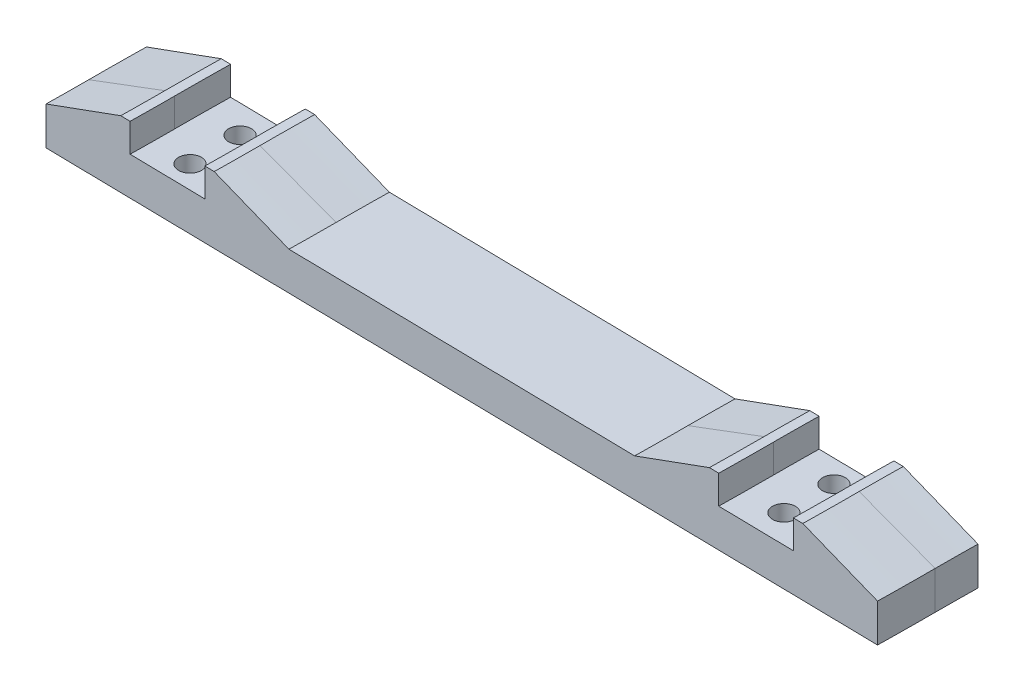
from build123d import *

# Parameters (mm, degrees)
EXTRUDE_1_DEPTH     = 2.5
SKETCH_5_R          = 0.6
CUT_EXTRUDE_1_DEPTH = 19.036421485
CUT_EXTRUDE_START   = -2
SKETCH_5_3_R        = 1
CUT_EXTRUDE_2_DEPTH = 1
REVOLVE_1_ANGLE     = 1
SKETCH_9_R          = 0.6
CUT_EXTRUDE_3_DEPTH = 41.426698916
SKETCH_9_3_R        = 1
CUT_EXTRUDE_4_DEPTH = 1
SKETCH_10_W         = 44.5
SKETCH_10_H         = 2.5
CUT_EXTRUDE_5_DEPTH = 41.528606999
REVOLVE_2_ANGLE     = 1
SKETCH_14_R         = 0.6
CUT_EXTRUDE_6_DEPTH = 41.445950592
SKETCH_14_3_R       = 1
CUT_EXTRUDE_7_DEPTH = 1


with BuildPart() as part:
    # 草图4 → 凸台-拉伸1 (new body)
    with BuildSketch(Plane.XY):
        Polygon((8.5, -1.5), (17.75, -1.5), (17.75, -3.5), (-4.5, -3.5), (-4.5, -1.5), (-0.5, 0), (0, 0), (0, -1.5), (4, -1.5), (4, 0), (4.5, 0), align=None)
    extrude(amount=EXTRUDE_1_DEPTH)

    # 草图5 → 切除-拉伸1 (cut, through all)
    with BuildSketch(Plane(origin=(0, -1.5, 0), x_dir=(1, 0, 0), z_dir=(0, 1, 0))):
        with Locations(Location((2, -1.25, 0), (0, 0, 270))):
            Circle(SKETCH_5_R)
    extrude(amount=-CUT_EXTRUDE_1_DEPTH, mode=Mode.SUBTRACT)

    # 草图5<3> → 切除-拉伸2 (cut)
    with BuildSketch(Plane(origin=(0, -1.5, 0), x_dir=(1, 0, 0), z_dir=(0, 1, 0)).offset(CUT_EXTRUDE_START)):
        with Locations((2, -1.25)):
            Circle(SKETCH_5_3_R)
    extrude(amount=CUT_EXTRUDE_2_DEPTH, mode=Mode.SUBTRACT)

    # 镜向1: part across plane


with BuildPart() as part_1:
    add(part.part)
    add(part.part.mirror(Plane(origin=(17.75, 0, 2.5), x_dir=(0, 0, 1), z_dir=(1, 0, 0))))

    # 草图6 → 旋转1 (revolve)
    with BuildSketch(Plane.XY.offset(2.5)):
        Polygon((0, 0), (-0.5, 0), (-4.5, -1.5), (-4.5, -3.5), (40, -3.5), (40, -1.5), (36, 0), (35.5, 0), (35.5, -1.5), (31.5, -1.5), (31.5, 0), (31, 0), (27, -1.5), (8.5, -1.5), (4.5, 0), (4, 0), (4, -1.5), (0, -1.5), align=None)
    revolve(axis=Axis((-132.25, 94.8535776, 2.5), (0, -1, 0)), revolution_arc=REVOLVE_1_ANGLE)

    # 草图9 → 切除-拉伸3 (cut, through all)
    with BuildSketch(Plane(origin=(0, -1.5, 0), x_dir=(1, 0, 0), z_dir=(0, 1, 0))):
        with Locations(Location((1.994888171, -3.671537391, 0), (0, 0, 180))):
            Circle(SKETCH_9_R)
        with Locations(Location((33.493688748, -3.946423259, 0), (0, 0, 180))):
            Circle(SKETCH_9_R)
    extrude(amount=-CUT_EXTRUDE_3_DEPTH, mode=Mode.SUBTRACT)

    # 草图9<3> → 切除-拉伸4 (cut)
    with BuildSketch(Plane(origin=(0, -1.5, 0), x_dir=(1, 0, 0), z_dir=(0, 1, 0)).offset(CUT_EXTRUDE_START)):
        with Locations((1.994888171, -3.671537391)):
            Circle(SKETCH_9_3_R)
        with Locations((33.493688748, -3.946423259)):
            Circle(SKETCH_9_3_R)
    extrude(amount=CUT_EXTRUDE_4_DEPTH, mode=Mode.SUBTRACT)

    # 草图10 → 切除-拉伸5 (cut, through all)
    with BuildSketch(Plane(origin=(0, 0, 0), x_dir=(1, 0, 0), z_dir=(0, 1, 0))):
        with Locations((17.75, -1.25)):
            Rectangle(SKETCH_10_W, SKETCH_10_H)
    extrude(amount=-CUT_EXTRUDE_5_DEPTH, mode=Mode.SUBTRACT)

    # 草图11 → 旋转2 (revolve)
    with BuildSketch(Plane(origin=(0, 0, 2.5), x_dir=(-1, 0, 0), z_dir=(0, 0, -1))):
        Polygon((0.5, 0), (0, 0), (0, -1.5), (-4, -1.5), (-4, 0), (-4.5, 0), (-8.5, -1.5), (-27, -1.5), (-31, 0), (-31.5, 0), (-31.5, -1.5), (-35.5, -1.5), (-35.5, 0), (-36, 0), (-40, -1.5), (-40, -3.5), (4.5, -3.5), (4.5, -1.5), align=None)
    revolve(axis=Axis((167.75, 63.011743597, 2.5), (0, -1, 0)), revolution_arc=REVOLVE_2_ANGLE)

    # 草图14 → 切除-拉伸6 (cut, through all)
    with BuildSketch(Plane(origin=(0, -1.5, 0), x_dir=(1, 0, 0), z_dir=(0, 1, 0))):
        with Locations(Location((2.006311252, -1.053576741, 0), (0, 0, 180))):
            Circle(SKETCH_14_R)
        with Locations(Location((33.505111829, -1.328462609, 0), (0, 0, 180))):
            Circle(SKETCH_14_R)
    extrude(amount=-CUT_EXTRUDE_6_DEPTH, mode=Mode.SUBTRACT)

    # 草图14<3> → 切除-拉伸7 (cut)
    with BuildSketch(Plane(origin=(0, -1.5, 0), x_dir=(1, 0, 0), z_dir=(0, 1, 0)).offset(CUT_EXTRUDE_START)):
        with Locations((2.006311252, -1.053576741)):
            Circle(SKETCH_14_3_R)
        with Locations((33.505111829, -1.328462609)):
            Circle(SKETCH_14_3_R)
    extrude(amount=CUT_EXTRUDE_7_DEPTH, mode=Mode.SUBTRACT)


solid = part_1.part
